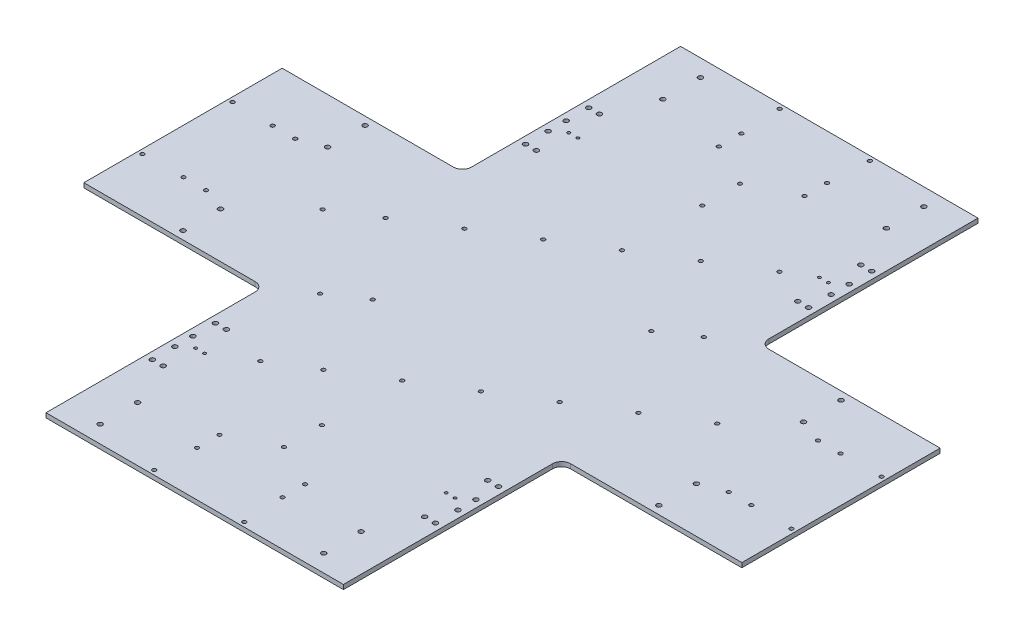
from build123d import *

# Parameters (mm, degrees)
BOSS_EXTRUDE1_DEPTH = 5
SKETCH2_R           = 2.125
CUT_EXTRUDE1_DEPTH  = 3
SKETCH4_R           = 2.6
SKETCH4_R_2         = 1.6
CUT_EXTRUDE3_DEPTH  = 10
SKETCH5_R           = 2.125
CUT_EXTRUDE4_DEPTH  = 10
FILLET1_R           = 10
SKETCH6_R           = 2.6
CUT_EXTRUDE5_DEPTH  = 10
SKETCH7_R           = 2.125
CUT_EXTRUDE6_DEPTH  = 10
SKETCH8_R           = 2.1
CUT_EXTRUDE7_DEPTH  = 10


with BuildPart() as part:
    # Sketch1 → Boss-Extrude1 (new body)
    with BuildSketch(Plane(origin=(0, 0, 0), x_dir=(1, 0, 0), z_dir=(0, 1, 0))):
        Polygon((165, 352), (-165, 352), (-165, 110), (-365, 110), (-365, -110), (-165, -110), (-165, -352), (165, -352), (165, -110), (365, -110), (365, 110), (165, 110), align=None)
    extrude(amount=BOSS_EXTRUDE1_DEPTH)

    # Sketch2 → Cut-Extrude1 (cut)
    with BuildSketch(Plane(origin=(0, 5, 0), x_dir=(1, 0, 0), z_dir=(0, 1, 0))):
        with Locations(Location((315, 49.5, 0), (0, 0, 270))):
            Circle(SKETCH2_R)
        with Locations(Location((290, 49.5, 0), (0, 0, 270))):
            Circle(SKETCH2_R)
        with Locations(Location((290, -49.5, 0), (0, 0, 90))):
            Circle(SKETCH2_R)
        with Locations(Location((315, -49.5, 0), (0, 0, 90))):
            Circle(SKETCH2_R)
        with Locations(Location((-315, -49.5, 0), (0, 0, 270))):
            Circle(SKETCH2_R)
        with Locations(Location((-290, -49.5, 0), (0, 0, 270))):
            Circle(SKETCH2_R)
        with Locations(Location((-290, 49.5, 0), (0, 0, 90))):
            Circle(SKETCH2_R)
        with Locations(Location((-315, 49.5, 0), (0, 0, 90))):
            Circle(SKETCH2_R)
        with Locations(Location((47.5, 302, 0), (0, 0, 270))):
            Circle(SKETCH2_R)
        with Locations(Location((47.5, 277, 0), (0, 0, 270))):
            Circle(SKETCH2_R)
        with Locations(Location((-47.5, 277, 0), (0, 0, 90))):
            Circle(SKETCH2_R)
        with Locations(Location((-47.5, 302, 0), (0, 0, 90))):
            Circle(SKETCH2_R)
        with Locations(Location((-47.5, -302, 0), (0, 0, 270))):
            Circle(SKETCH2_R)
        with Locations(Location((-47.5, -277, 0), (0, 0, 270))):
            Circle(SKETCH2_R)
        with Locations(Location((47.5, -277, 0), (0, 0, 90))):
            Circle(SKETCH2_R)
        with Locations(Location((47.5, -302, 0), (0, 0, 90))):
            Circle(SKETCH2_R)
    extrude(amount=-CUT_EXTRUDE1_DEPTH, mode=Mode.SUBTRACT)

    # Sketch4 → Cut-Extrude3 (cut)
    with BuildSketch(Plane(origin=(0, 5, 0), x_dir=(1, 0, 0), z_dir=(0, 1, 0))):
        with Locations(Location((-157, 172, 0), (0, 0, 270))):
            Circle(SKETCH4_R)
        with Locations(Location((-145, 172, 0), (0, 0, 270))):
            Circle(SKETCH4_R)
        with Locations(Location((-157, 197, 0), (0, 0, 270))):
            Circle(SKETCH4_R)
        with Locations(Location((-157, 217, 0), (0, 0, 270))):
            Circle(SKETCH4_R)
        with Locations(Location((-157, 242, 0), (0, 0, 270))):
            Circle(SKETCH4_R)
        with Locations(Location((-145, 242, 0), (0, 0, 270))):
            Circle(SKETCH4_R)
        with Locations(Location((145, 242, 0), (0, 0, 90))):
            Circle(SKETCH4_R)
        with Locations(Location((157, 242, 0), (0, 0, 90))):
            Circle(SKETCH4_R)
        with Locations(Location((157, 217, 0), (0, 0, 90))):
            Circle(SKETCH4_R)
        with Locations(Location((157, 197, 0), (0, 0, 90))):
            Circle(SKETCH4_R)
        with Locations(Location((145, 172, 0), (0, 0, 90))):
            Circle(SKETCH4_R)
        with Locations(Location((157, 172, 0), (0, 0, 90))):
            Circle(SKETCH4_R)
        with Locations(Location((157, -172, 0), (0, 0, 270))):
            Circle(SKETCH4_R)
        with Locations(Location((145, -172, 0), (0, 0, 270))):
            Circle(SKETCH4_R)
        with Locations(Location((157, -197, 0), (0, 0, 270))):
            Circle(SKETCH4_R)
        with Locations(Location((157, -217, 0), (0, 0, 270))):
            Circle(SKETCH4_R)
        with Locations(Location((157, -242, 0), (0, 0, 270))):
            Circle(SKETCH4_R)
        with Locations(Location((145, -242, 0), (0, 0, 270))):
            Circle(SKETCH4_R)
        with Locations(Location((-145, -242, 0), (0, 0, 90))):
            Circle(SKETCH4_R)
        with Locations(Location((-157, -242, 0), (0, 0, 90))):
            Circle(SKETCH4_R)
        with Locations(Location((-157, -217, 0), (0, 0, 90))):
            Circle(SKETCH4_R)
        with Locations(Location((-157, -197, 0), (0, 0, 90))):
            Circle(SKETCH4_R)
        with Locations(Location((-145, -172, 0), (0, 0, 90))):
            Circle(SKETCH4_R)
        with Locations(Location((-157, -172, 0), (0, 0, 90))):
            Circle(SKETCH4_R)
        with Locations(Location((144, -207, 0), (0, 0, 270))):
            Circle(SKETCH4_R_2)
        with Locations(Location((-144, -207, 0), (0, 0, 90))):
            Circle(SKETCH4_R_2)
        with Locations(Location((144, 207, 0), (0, 0, 90))):
            Circle(SKETCH4_R_2)
        with Locations(Location((-144, 207, 0), (0, 0, 270))):
            Circle(SKETCH4_R_2)
        with Locations(Location((134, -207, 0), (0, 0, 270))):
            Circle(SKETCH4_R_2)
        with Locations(Location((-134, -207, 0), (0, 0, 90))):
            Circle(SKETCH4_R_2)
        with Locations(Location((134, 207, 0), (0, 0, 90))):
            Circle(SKETCH4_R_2)
        with Locations(Location((-134, 207, 0), (0, 0, 270))):
            Circle(SKETCH4_R_2)
    extrude(amount=-CUT_EXTRUDE3_DEPTH, mode=Mode.SUBTRACT)

    # Sketch5 → Cut-Extrude4 (cut)
    with BuildSketch(Plane(origin=(0, 5, 0), x_dir=(1, 0, 0), z_dir=(0, 1, 0))):
        with Locations(Location((-50, 347, 0), (0, 0, 270))):
            Circle(SKETCH5_R)
        with Locations(Location((50, 347, 0), (0, 0, 270))):
            Circle(SKETCH5_R)
        with Locations(Location((50, -347, 0), (0, 0, 90))):
            Circle(SKETCH5_R)
        with Locations(Location((-50, -347, 0), (0, 0, 90))):
            Circle(SKETCH5_R)
        with Locations(Location((-360, 50, 0), (0, 0, 270))):
            Circle(SKETCH5_R)
        with Locations(Location((-360, -50, 0), (0, 0, 270))):
            Circle(SKETCH5_R)
        with Locations(Location((360, -50, 0), (0, 0, 90))):
            Circle(SKETCH5_R)
        with Locations(Location((360, 50, 0), (0, 0, 90))):
            Circle(SKETCH5_R)
    extrude(amount=-CUT_EXTRUDE4_DEPTH, mode=Mode.SUBTRACT)

    # Fillet1
    fillet1_edges = [part.edges().sort_by_distance(p)[0] for p in [
        (165, 2.5, -110),
        (165, 2.5, 110),
        (-165, 2.5, 110),
        (-165, 2.5, -110),
    ]]
    fillet(fillet1_edges, radius=FILLET1_R)

    # Sketch6 → Cut-Extrude5 (cut)
    with BuildSketch(Plane(origin=(0, 5, 0), x_dir=(1, 0, 0), z_dir=(0, 1, 0))):
        with Locations(Location((124, 333, 0), (0, 0, 270))):
            Circle(SKETCH6_R)
        with Locations(Location((124, 291.4, 0), (0, 0, 270))):
            Circle(SKETCH6_R)
        with Locations(Location((124, -291.4, 0), (0, 0, 90))):
            Circle(SKETCH6_R)
        with Locations(Location((124, -333, 0), (0, 0, 90))):
            Circle(SKETCH6_R)
        with Locations(Location((-124, -333, 0), (0, 0, 270))):
            Circle(SKETCH6_R)
        with Locations(Location((-124, -291.4, 0), (0, 0, 270))):
            Circle(SKETCH6_R)
        with Locations(Location((-124, 291.4, 0), (0, 0, 90))):
            Circle(SKETCH6_R)
        with Locations(Location((-124, 333, 0), (0, 0, 90))):
            Circle(SKETCH6_R)
        with Locations(Location((264, 101, 0), (0, 0, 270))):
            Circle(SKETCH6_R)
        with Locations(Location((264, 59.4, 0), (0, 0, 270))):
            Circle(SKETCH6_R)
        with Locations(Location((264, -59.4, 0), (0, 0, 90))):
            Circle(SKETCH6_R)
        with Locations(Location((264, -101, 0), (0, 0, 90))):
            Circle(SKETCH6_R)
        with Locations(Location((-264, -101, 0), (0, 0, 270))):
            Circle(SKETCH6_R)
        with Locations(Location((-264, -59.4, 0), (0, 0, 270))):
            Circle(SKETCH6_R)
        with Locations(Location((-264, 59.4, 0), (0, 0, 90))):
            Circle(SKETCH6_R)
        with Locations(Location((-264, 101, 0), (0, 0, 90))):
            Circle(SKETCH6_R)
    extrude(amount=-CUT_EXTRUDE5_DEPTH, mode=Mode.SUBTRACT)

    # Sketch7 → Cut-Extrude6 (cut)
    with BuildSketch(Plane(origin=(0, 5, 0), x_dir=(1, 0, 0), z_dir=(0, 1, 0))):
        with Locations(Location((-55.682048102, 90.197059371, 0), (0, 0, 270))):
            Circle(SKETCH7_R)
        with Locations(Location((-1.648904044, 123.553757998, 0), (0, 0, 270))):
            Circle(SKETCH7_R)
        with Locations(Location((52.384240013, 156.910456625, 0), (0, 0, 270))):
            Circle(SKETCH7_R)
        with Locations(Location((106.41738407, 190.267155252, 0), (0, 0, 270))):
            Circle(SKETCH7_R)
        with Locations(Location((-109.715192159, 56.840360744, 0), (0, 0, 270))):
            Circle(SKETCH7_R)
        with Locations(Location((-163.748336216, 23.483662117, 0), (0, 0, 270))):
            Circle(SKETCH7_R)
        with Locations(Location((-206.974851462, -3.201696784, 0), (0, 0, 270))):
            Circle(SKETCH7_R)
        with Locations(Location((-95.610755259, -183.595815527, 0), (0, 0, 90))):
            Circle(SKETCH7_R)
        with Locations(Location((-52.384240013, -156.910456625, 0), (0, 0, 90))):
            Circle(SKETCH7_R)
        with Locations(Location((1.648904044, -123.553757998, 0), (0, 0, 90))):
            Circle(SKETCH7_R)
        with Locations(Location((217.781480273, 9.87303651, 0), (0, 0, 90))):
            Circle(SKETCH7_R)
        with Locations(Location((163.748336216, -23.483662117, 0), (0, 0, 90))):
            Circle(SKETCH7_R)
        with Locations(Location((109.715192159, -56.840360744, 0), (0, 0, 90))):
            Circle(SKETCH7_R)
        with Locations(Location((55.682048102, -90.197059371, 0), (0, 0, 90))):
            Circle(SKETCH7_R)
    extrude(amount=-CUT_EXTRUDE6_DEPTH, mode=Mode.SUBTRACT)

    # Sketch8 → Cut-Extrude7 (cut)
    with BuildSketch(Plane(origin=(0, 5, 0), x_dir=(1, 0, 0), z_dir=(0, 1, 0))):
        with Locations(Location((-127.267902287, -85.585182493, 0), (0, 0, 270))):
            Circle(SKETCH8_R)
        with Locations(Location((-92.415590944, -62.147682754, 0), (0, 0, 270))):
            Circle(SKETCH8_R)
        with Locations(Location((92.415590944, 62.147682754, 0), (0, 0, 270))):
            Circle(SKETCH8_R)
        with Locations(Location((127.267902287, 85.585182493, 0), (0, 0, 270))):
            Circle(SKETCH8_R)
        with Locations(Location((0, 253, 0), (0, 0, 270))):
            Circle(SKETCH8_R)
        with Locations(Location((0, 211, 0), (0, 0, 270))):
            Circle(SKETCH8_R)
        with Locations(Location((0, -211, 0), (0, 0, 90))):
            Circle(SKETCH8_R)
        with Locations(Location((0, -253, 0), (0, 0, 90))):
            Circle(SKETCH8_R)
    extrude(amount=-CUT_EXTRUDE7_DEPTH, mode=Mode.SUBTRACT)


solid = part.part
